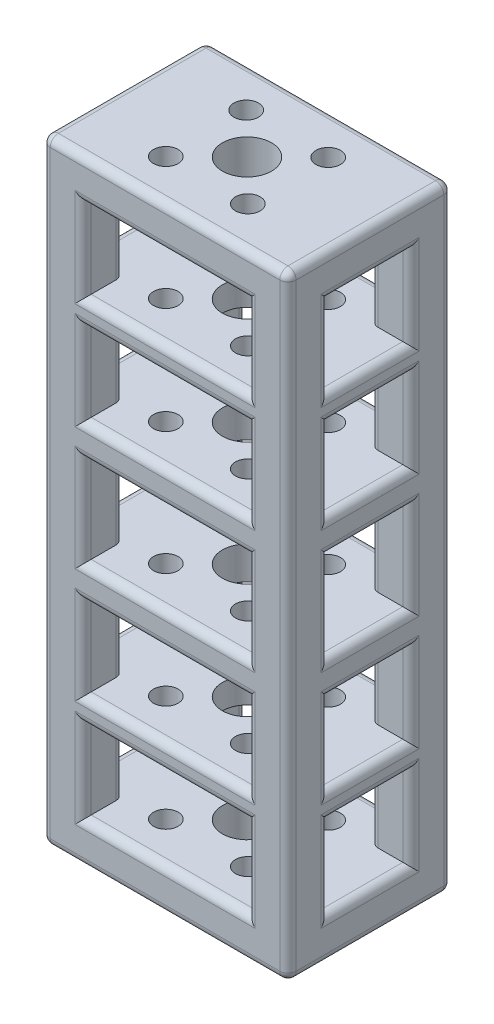
from build123d import *

# Parameters (mm, degrees)
SZKIC1_W                        = 30
SZKIC1_H                        = 20
SZKIC1_R                        = 3
SZKIC1_R_2                      = 1.5
DODANIE_WYCI_GNI_CIE1_DEPTH     = 75
WYTNIJ_WYCI_GNI_CIE1_DEPTH      = 60
WYTNIJ_WYCI_GNI_CIE1_DEPTH_BACK = 79
SZKIC2_W                        = 10
SZKIC2_H                        = 10
SZKIC2_H_2                      = 11
SZKIC3_W                        = 20
SZKIC3_H                        = 10
SZKIC3_H_2                      = 11
WYTNIJ_WYCI_GNI_CIE3_DEPTH      = 260
ZAOKR_GLENIE12_R                = 1
ZAOKR_GLENIE13_R                = 1


with BuildPart() as part:
    # Szkic1 → Dodanie-wyciągnięcie1 (new body)
    with BuildSketch(Plane(origin=(0, 0, 0), x_dir=(1, 0, 0), z_dir=(0, 1, 0))):
        with Locations((15, 10)):
            Rectangle(SZKIC1_W, SZKIC1_H)
        with Locations(Location((15, 10, 0), (0, 0, 270))):
            Circle(SZKIC1_R, mode=Mode.SUBTRACT)
        with Locations(Location((10, 14.9, 0), (0, 0, 270))):
            Circle(SZKIC1_R_2, mode=Mode.SUBTRACT)
        with Locations(Location((20, 14.9, 0), (0, 0, 270))):
            Circle(SZKIC1_R_2, mode=Mode.SUBTRACT)
        with Locations(Location((20, 5.1, 0), (0, 0, 270))):
            Circle(SZKIC1_R_2, mode=Mode.SUBTRACT)
        with Locations(Location((10, 5.1, 0), (0, 0, 270))):
            Circle(SZKIC1_R_2, mode=Mode.SUBTRACT)
    extrude(amount=DODANIE_WYCI_GNI_CIE1_DEPTH)

    # Szkic2 → Wytnij-wyciągnięcie1 (cut, two sides: drawn at the far end of the back side and taken through both)
    with BuildSketch(Plane(origin=(30, 0, 0), x_dir=(0, 0, -1), z_dir=(1, 0, 0)).offset(-WYTNIJ_WYCI_GNI_CIE1_DEPTH_BACK)):
        with Locations((10, 65)):
            Rectangle(SZKIC2_W, SZKIC2_H)
        with Locations((10, 52)):
            Rectangle(SZKIC2_W, SZKIC2_H)
        with Locations((10, 10)):
            Rectangle(SZKIC2_W, SZKIC2_H)
        with Locations((10, 37.5)):
            Rectangle(SZKIC2_W, SZKIC2_H_2)
        with Locations((10, 23)):
            Rectangle(SZKIC2_W, SZKIC2_H)
    extrude(amount=WYTNIJ_WYCI_GNI_CIE1_DEPTH + WYTNIJ_WYCI_GNI_CIE1_DEPTH_BACK, mode=Mode.SUBTRACT)

    # Szkic3 → Wytnij-wyciągnięcie3 (cut)
    with BuildSketch(Plane.XY):
        with Locations((15, 65)):
            Rectangle(SZKIC3_W, SZKIC3_H)
        with Locations((15, 52)):
            Rectangle(SZKIC3_W, SZKIC3_H)
        with Locations((15, 10)):
            Rectangle(SZKIC3_W, SZKIC3_H)
        with Locations((15, 37.5)):
            Rectangle(SZKIC3_W, SZKIC3_H_2)
        with Locations((15, 23)):
            Rectangle(SZKIC3_W, SZKIC3_H)
    extrude(amount=-WYTNIJ_WYCI_GNI_CIE3_DEPTH, mode=Mode.SUBTRACT)

    # Zaokrąglenie12
    zaokr_glenie12_edges = [part.edges().sort_by_distance(p)[0] for p in [
        (0, 23, -15),
        (30, 23, -5),
        (0, 18, -10),
        (0, 28, -10),
        (0, 23, -5),
        (30, 18, -10),
        (30, 23, -15),
        (30, 28, -10),
        (30, 75, -10),
        (0, 37.5, -15),
        (30, 37.5, -5),
        (0, 32, -10),
        (0, 43, -10),
        (0, 37.5, -5),
        (30, 32, -10),
        (30, 37.5, -15),
        (30, 43, -10),
        (0, 10, -15),
        (30, 10, -5),
        (0, 5, -10),
        (0, 15, -10),
        (0, 10, -5),
        (30, 5, -10),
        (30, 10, -15),
        (30, 15, -10),
        (15, 75, -20),
        (0, 52, -15),
        (30, 52, -5),
        (0, 47, -10),
        (0, 57, -10),
        (0, 52, -5),
        (30, 47, -10),
        (30, 52, -15),
        (30, 57, -10),
        (15, 70, -20),
        (5, 65, -20),
        (25, 65, -20),
        (15, 60, -20),
        (5, 65, 0),
        (15, 60, 0),
        (25, 65, 0),
        (15, 70, 0),
        (5, 23, -20),
        (25, 23, -20),
        (15, 18, -20),
        (15, 28, -20),
        (5, 23, 0),
        (15, 18, 0),
        (25, 23, 0),
        (15, 28, 0),
        (5, 37.5, -20),
        (25, 37.5, -20),
        (15, 43, -20),
        (15, 32, -20),
        (5, 37.5, 0),
        (15, 32, 0),
        (25, 37.5, 0),
        (15, 43, 0),
        (15, 5, -20),
        (5, 10, -20),
        (25, 10, -20),
        (15, 15, -20),
        (5, 10, 0),
        (15, 5, 0),
        (25, 10, 0),
        (15, 15, 0),
        (5, 52, -20),
        (25, 52, -20),
        (15, 57, -20),
        (15, 47, -20),
        (5, 52, 0),
        (15, 47, 0),
        (25, 52, 0),
        (15, 57, 0),
        (0, 75, -10),
        (15, 0, -20),
        (30, 0, -10),
        (15, 0, 0),
        (0, 0, -10),
        (0, 37.5, -20),
        (30, 37.5, -20),
        (30, 37.5, 0),
        (0, 37.5, 0),
        (15, 75, 0),
        (0, 65, -15),
        (30, 65, -5),
        (0, 60, -10),
        (0, 70, -10),
        (0, 65, -5),
        (30, 60, -10),
        (30, 65, -15),
        (30, 70, -10),
    ]]
    fillet(zaokr_glenie12_edges, radius=ZAOKR_GLENIE12_R)

    # Zaokrąglenie13
    zaokr_glenie13_edges = [part.edges().sort_by_distance(p)[0] for p in [
        (5, 65, -15),
        (5, 65, -5),
        (25, 65, -15),
        (25, 65, -5),
        (5, 23, -15),
        (5, 23, -5),
        (25, 23, -15),
        (25, 23, -5),
        (5, 37.5, -15),
        (5, 37.5, -5),
        (25, 37.5, -15),
        (25, 37.5, -5),
        (5, 10, -15),
        (5, 10, -5),
        (25, 10, -15),
        (25, 10, -5),
        (5, 52, -15),
        (5, 52, -5),
        (25, 52, -15),
        (25, 52, -5),
    ]]
    fillet(zaokr_glenie13_edges, radius=ZAOKR_GLENIE13_R)


solid = part.part
